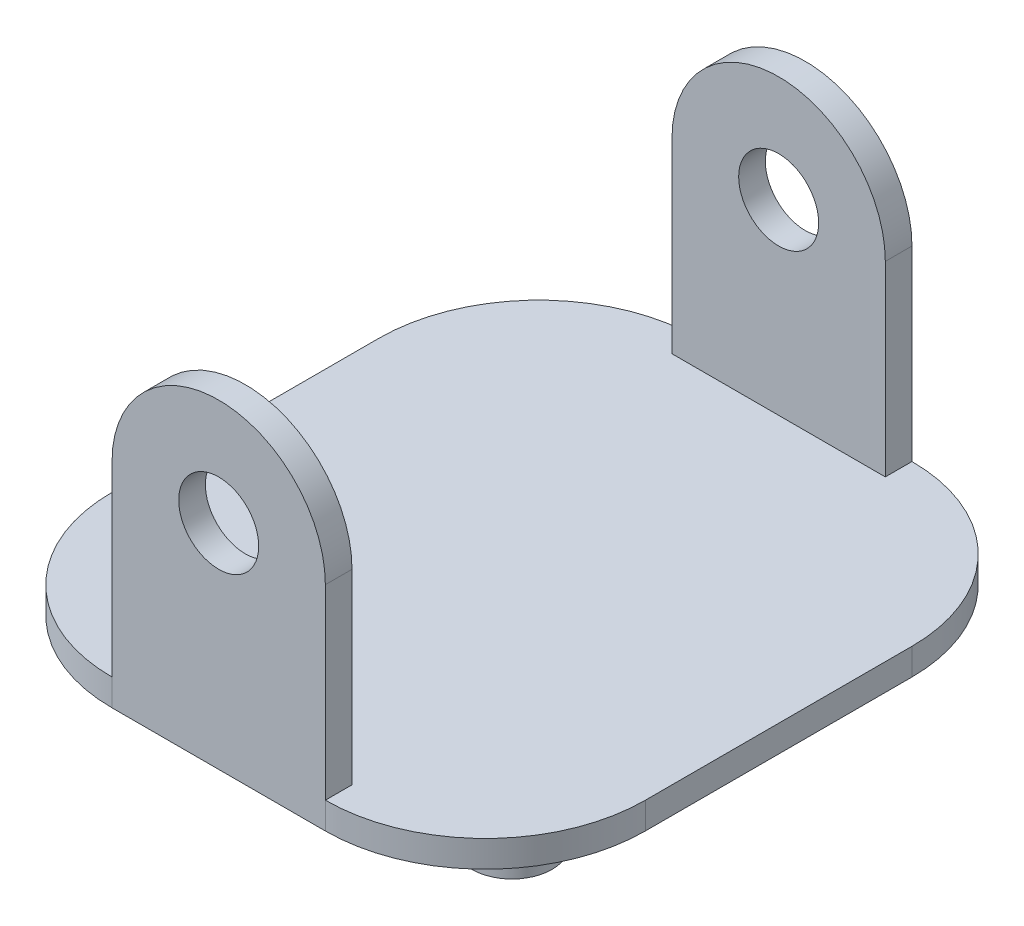
from build123d import *

# Parameters (mm, degrees)
CROQUIS1_W              = 20
CROQUIS1_H              = 22
SALIENTE_EXTRUIR1_DEPTH = 1
CROQUIS2_W              = 8
CROQUIS2_H              = 1
SALIENTE_EXTRUIR2_DEPTH = 20
CROQUIS3_R              = 1.5
CORTAR_EXTRUIR1_DEPTH   = 33.015621187
CROQUIS4_R              = 1.5
SALIENTE_EXTRUIR3_DEPTH = 8
REDONDEO1_R             = 6


with BuildPart() as part:
    # Croquis1 → Saliente-Extruir1 (new body)
    with BuildSketch(Plane(origin=(0, 0, 0), x_dir=(1, 0, 0), z_dir=(0, 1, 0))):
        Rectangle(CROQUIS1_W, CROQUIS1_H)
    extrude(amount=SALIENTE_EXTRUIR1_DEPTH)

    # Croquis2 → Saliente-Extruir2 (add)
    with BuildSketch(Plane(origin=(0, 1, 0), x_dir=(1, 0, 0), z_dir=(0, 1, 0))):
        with Locations((0, -10.5)):
            Rectangle(CROQUIS2_W, CROQUIS2_H)
        with Locations((0, 10.5)):
            Rectangle(CROQUIS2_W, CROQUIS2_H)
    extrude(amount=SALIENTE_EXTRUIR2_DEPTH)

    # Croquis3 → Cortar-Extruir1 (cut, through all)
    with BuildSketch(Plane.XY.offset(11)):
        with Locations((0, 8)):
            Circle(CROQUIS3_R)
        with BuildLine():
            Line((-4, 8), (-13.08141652, 8))
            Line((-13.08141652, 8), (-13.08141652, 28.561512487))
            Line((-13.08141652, 28.561512487), (15.549721507, 28.561512487))
            Line((15.549721507, 28.561512487), (15.549721507, 8))
            Line((15.549721507, 8), (4, 8))
            ThreePointArc((4, 8), (0, 12), (-4, 8))
        make_face()
    extrude(amount=-CORTAR_EXTRUIR1_DEPTH, mode=Mode.SUBTRACT)

    # Croquis4 → Saliente-Extruir3 (add)
    with BuildSketch(Plane.XZ):
        with Locations(Location((0, 0, 0), (0, 0, 270))):
            Circle(CROQUIS4_R)
    extrude(amount=SALIENTE_EXTRUIR3_DEPTH)

    # Redondeo1
    redondeo1_edges = [part.edges().sort_by_distance(p)[0] for p in [
        (-10, 0.5, -11),
        (-10, 0.5, 11),
        (10, 0.5, -11),
        (10, 0.5, 11),
    ]]
    fillet(redondeo1_edges, radius=REDONDEO1_R)


solid = part.part
